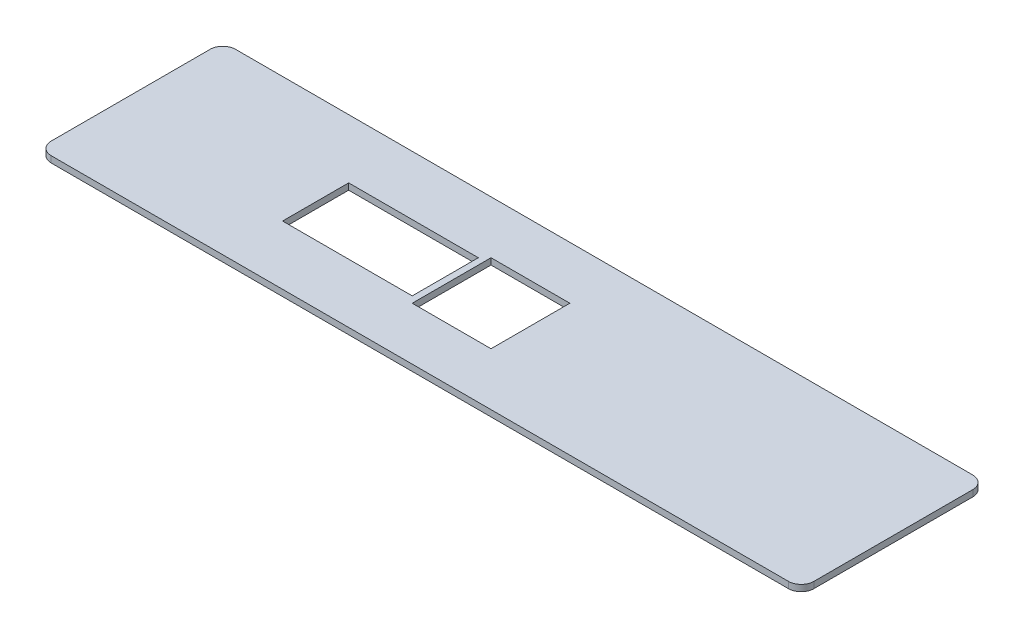
from build123d import *

# Parameters (mm, degrees)
SKETCH2_W           = 20.4
SKETCH2_H           = 10.4
SKETCH2_W_2         = 12.4
SKETCH2_H_2         = 12.4
BOSS_EXTRUDE1_DEPTH = 1


with BuildPart() as part:
    # Sketch2 → Boss-Extrude1 (new body)
    with BuildSketch(Plane(origin=(0, 0, 0), x_dir=(1, 0, 0), z_dir=(0, 1, 0))):
        with BuildLine():
            Line((0, 12.5), (0, -12.5))
            ThreePointArc((0, -12.5), (0.585786438, -13.914213562), (2, -14.5))
            Line((2, -14.5), (118, -14.5))
            ThreePointArc((118, -14.5), (119.414213562, -13.914213562), (120, -12.5))
            Line((120, -12.5), (120, 12.5))
            ThreePointArc((120, 12.5), (119.414213562, 13.914213562), (118, 14.5))
            Line((118, 14.5), (2, 14.5))
            ThreePointArc((2, 14.5), (0.585786438, 13.914213562), (0, 12.5))
        make_face()
        with Locations((39.3, 0)):
            Rectangle(SKETCH2_W, SKETCH2_H, mode=Mode.SUBTRACT)
        with Locations((56.7, 0)):
            Rectangle(SKETCH2_W_2, SKETCH2_H_2, mode=Mode.SUBTRACT)
    extrude(amount=BOSS_EXTRUDE1_DEPTH)


solid = part.part
